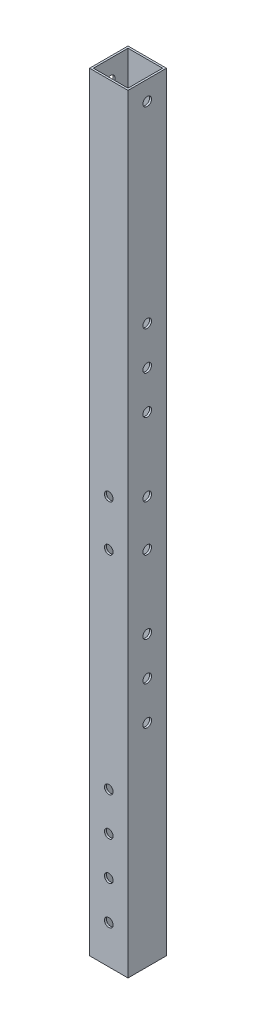
from build123d import *

# Parameters (mm, degrees)
SKETCH1_W           = 20
SKETCH1_H           = 20
SKETCH1_W_2         = 18
SKETCH1_H_2         = 18
BOSS_EXTRUDE1_DEPTH = 400
SKETCH4_R           = 2.25
CUT_EXTRUDE1_DEPTH  = 401.62451248
SKETCH5_R           = 2.25
CUT_EXTRUDE2_DEPTH  = 401.62451248


with BuildPart() as part:
    # Sketch1 → Boss-Extrude1 (new body)
    with BuildSketch(Plane(origin=(0, 0, 0), x_dir=(1, 0, 0), z_dir=(0, 1, 0))):
        Rectangle(SKETCH1_W, SKETCH1_H)
        Rectangle(SKETCH1_W_2, SKETCH1_H_2, mode=Mode.SUBTRACT)
    extrude(amount=BOSS_EXTRUDE1_DEPTH)

    # Sketch4 → Cut-Extrude1 (cut, through all)
    with BuildSketch(Plane(origin=(0, 0, -10), x_dir=(-1, 0, 0), z_dir=(0, 0, -1))):
        with Locations((0, 20)):
            Circle(SKETCH4_R)
        with Locations((0, 40)):
            Circle(SKETCH4_R)
        with Locations((0, 60)):
            Circle(SKETCH4_R)
        with Locations((0, 80)):
            Circle(SKETCH4_R)
        with Locations((0, 188)):
            Circle(SKETCH4_R)
        with Locations(Location((0, 212, 0), (0, 0, 180))):
            Circle(SKETCH4_R)
    extrude(amount=-CUT_EXTRUDE1_DEPTH, mode=Mode.SUBTRACT)

    # Sketch5 → Cut-Extrude2 (cut, through all)
    with BuildSketch(Plane.ZY.offset(10)):
        with Locations((0, 188)):
            Circle(SKETCH5_R)
        with Locations((0, 212)):
            Circle(SKETCH5_R)
        with Locations((0, 110)):
            Circle(SKETCH5_R)
        with Locations((0, 130)):
            Circle(SKETCH5_R)
        with Locations((0, 150)):
            Circle(SKETCH5_R)
        with Locations(Location((0, 250, 0), (0, 0, 180))):
            Circle(SKETCH5_R)
        with Locations(Location((0, 290, 0), (0, 0, 180))):
            Circle(SKETCH5_R)
        with Locations(Location((0, 270, 0), (0, 0, 180))):
            Circle(SKETCH5_R)
        with Locations(Location((0, 390, 0), (0, 0, 180))):
            Circle(SKETCH5_R)
    extrude(amount=-CUT_EXTRUDE2_DEPTH, mode=Mode.SUBTRACT)


solid = part.part
